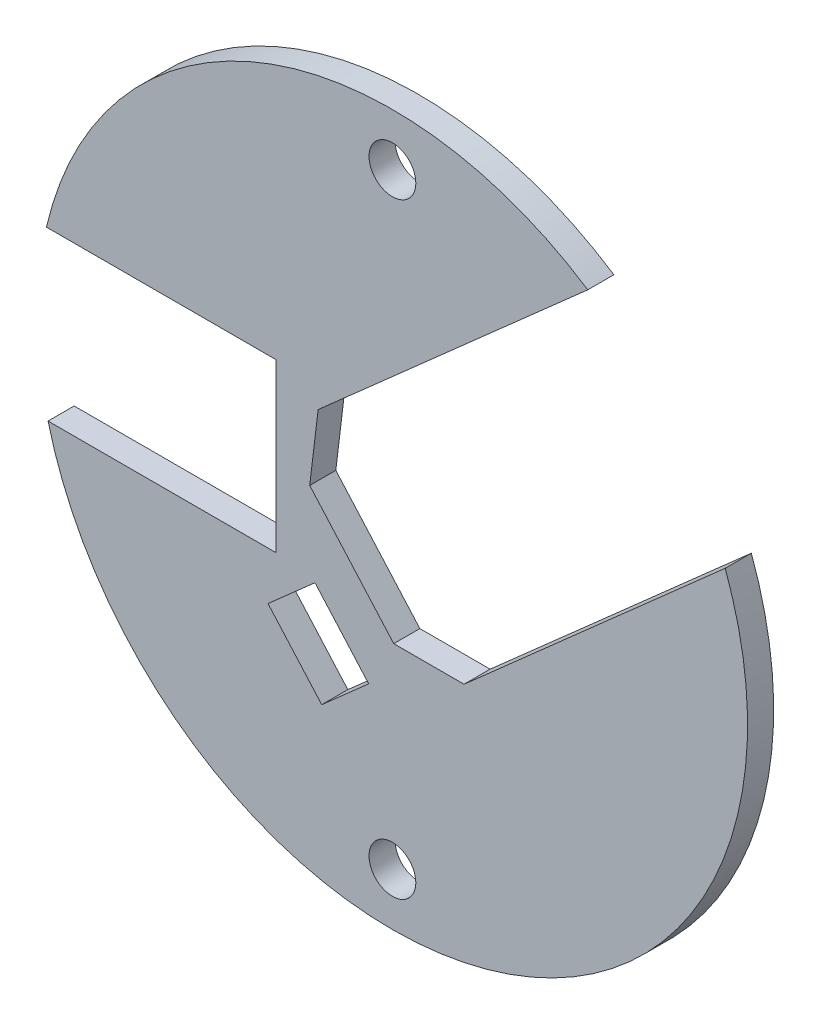
from build123d import *

# Parameters (mm, degrees)
SKETCH1_R           = 1.4224
BOSS_EXTRUDE1_DEPTH = 1.5875


with BuildPart() as part:
    # Sketch1 → Boss-Extrude1 (new body)
    with BuildSketch(Plane.XY):
        with BuildLine():
            Line((-5.027565338, -0.720652536), (-4.515281158, 3.5306))
            Line((-4.515281158, 3.5306), (11.876076152, 18.030166811))
            ThreePointArc((11.876076152, 18.030166811), (-8.013144755, 20.047882959), (-21.031997569, 4.8768))
            Line((-21.031997569, 4.8768), (-7.084965338, 4.8768))
            Line((-7.084965338, 4.8768), (-7.084965338, -5.2832))
            Line((-7.084965338, -5.2832), (-20.933606898, -5.2832))
            ThreePointArc((-20.933606898, -5.2832), (2.661909754, -21.425273311), (21.59, 0))
            ThreePointArc((21.59, 0), (21.246782402, 3.834362733), (20.228041911, 7.546815251))
            Line((20.228041911, 7.546815251), (4.353635591, -6.495463901))
            Line((4.353635591, -6.495463901), (0.080752517, -6.495463901))
            Line((0.080752517, -6.495463901), (-5.027565338, -0.720652536))
        make_face()
        with Locations((0, -18.415)):
            Circle(SKETCH1_R, mode=Mode.SUBTRACT)
        Polygon((-7.562063797, -8.206208525), (-4.708345419, -5.681848919), (-1.443506996, -9.372658021), (-4.297225374, -11.897017627), align=None, mode=Mode.SUBTRACT)
        with Locations((0, 18.415)):
            Circle(SKETCH1_R, mode=Mode.SUBTRACT)
    extrude(amount=BOSS_EXTRUDE1_DEPTH)


solid = part.part
